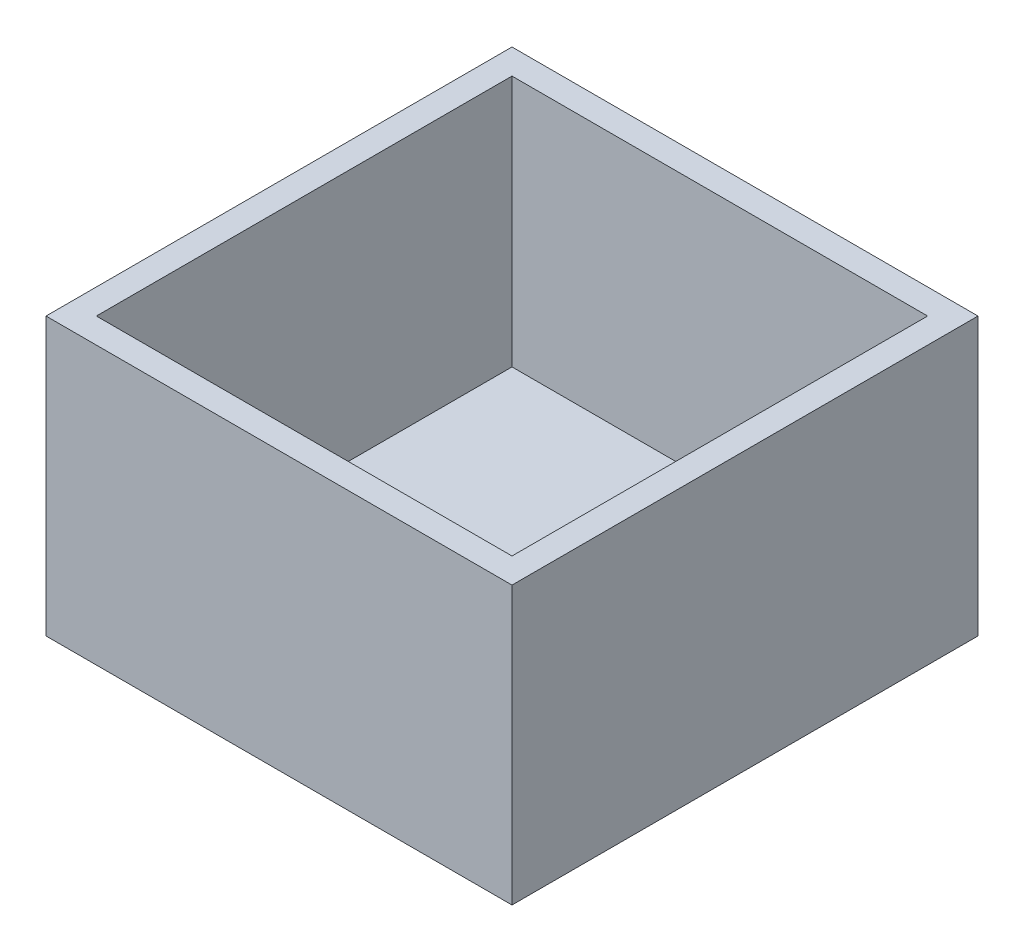
from build123d import *

# Parameters (mm, degrees)
SKETCH2_W           = 92.5
SKETCH2_H           = 92.5
BOSS_EXTRUDE1_DEPTH = 55
SKETCH3_W           = 82.5
SKETCH3_H           = 82.5
CUT_EXTRUDE1_DEPTH  = 50


with BuildPart() as part:
    # Sketch2 → Boss-Extrude1 (new body)
    with BuildSketch(Plane(origin=(0, 0, 0), x_dir=(1, 0, 0), z_dir=(0, 1, 0))):
        with Locations((41.25, -41.25)):
            Rectangle(SKETCH2_W, SKETCH2_H)
    extrude(amount=BOSS_EXTRUDE1_DEPTH)

    # Sketch3 → Cut-Extrude1 (cut)
    with BuildSketch(Plane(origin=(0, 55, 0), x_dir=(1, 0, 0), z_dir=(0, 1, 0))):
        with Locations((41.25, -41.25)):
            Rectangle(SKETCH3_W, SKETCH3_H)
    extrude(amount=-CUT_EXTRUDE1_DEPTH, mode=Mode.SUBTRACT)


solid = part.part
